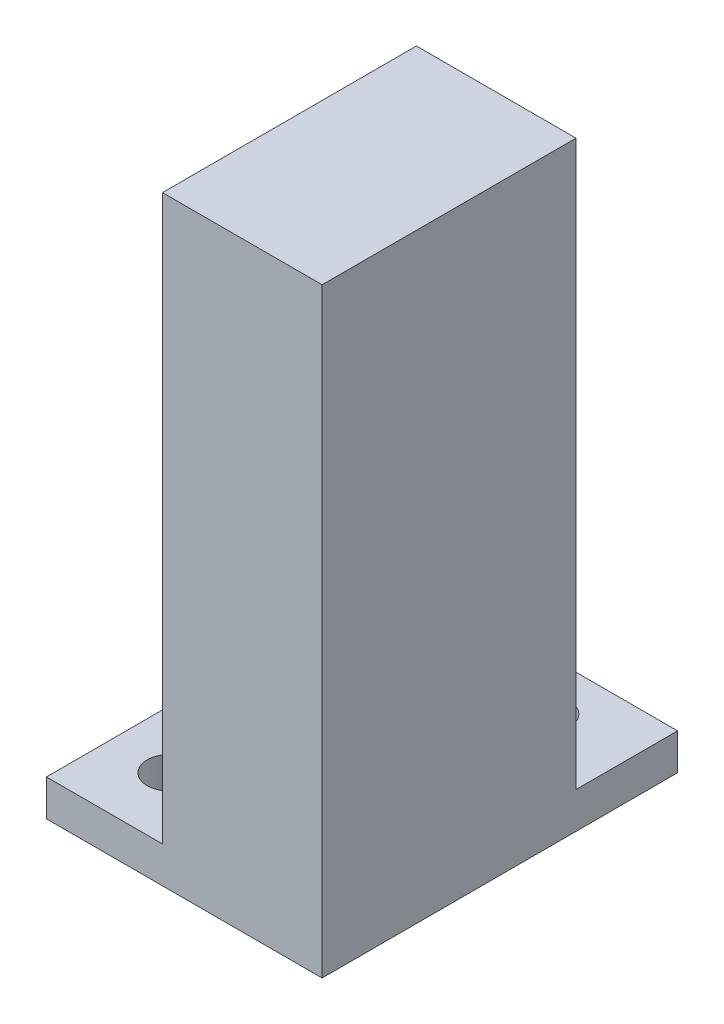
from build123d import *

# Parameters (mm, degrees)
SKETCH1_W           = 22
SKETCH1_H           = 82.75
SKETCH1_R           = 3.1
BOSS_EXTRUDE1_DEPTH = 30
SKETCH2_W           = 22
SKETCH2_H           = 82.75
BOSS_EXTRUDE2_DEPTH = 5
SKETCH3_W           = 16
SKETCH3_H           = 35
SKETCH3_R           = 3.1
SKETCH3_W_2         = 22
SKETCH3_H_2         = 14
BOSS_EXTRUDE3_DEPTH = 5
BOSS_EXTRUDE5_START = 15
SKETCH5_R           = 3.1
BOSS_EXTRUDE5_DEPTH = 15


with BuildPart() as part:
    # Sketch1 → Boss-Extrude1 (new body)
    with BuildSketch(Plane.XY):
        with Locations((0, 7.844654309)):
            Rectangle(SKETCH1_W, SKETCH1_H)
        with Locations((0, 35.719654309)):
            Circle(SKETCH1_R, mode=Mode.SUBTRACT)
        with Locations((0, 7.719654309)):
            Circle(SKETCH1_R, mode=Mode.SUBTRACT)
    extrude(amount=BOSS_EXTRUDE1_DEPTH)

    # Sketch2 → Boss-Extrude2 (add)
    with BuildSketch(Plane.XY.offset(30)):
        with Locations((0, 7.844654309)):
            Rectangle(SKETCH2_W, SKETCH2_H)
    extrude(amount=BOSS_EXTRUDE2_DEPTH)

    # Sketch3 → Boss-Extrude3 (add)
    # profile 1 of 2: a face of its own
    with BuildSketch(Plane.XZ.offset(33.530345691)):
        with Locations((-19, 17.5)):
            Rectangle(SKETCH3_W, SKETCH3_H)
        with Locations(Location((-19, 26, 0), (0, 0, 270))):
            Circle(SKETCH3_R, mode=Mode.SUBTRACT)
        with Locations(Location((-19, 9, 0), (0, 0, 270))):
            Circle(SKETCH3_R, mode=Mode.SUBTRACT)
    # profile 2 of 2: a face of its own
    with BuildSketch(Plane.XZ.offset(33.530345691)):
        with Locations((0, -7)):
            Rectangle(SKETCH3_W_2, SKETCH3_H_2)
        with Locations(Location((0, -7, 0), (0, 0, 270))):
            Circle(SKETCH3_R, mode=Mode.SUBTRACT)
    extrude(amount=-BOSS_EXTRUDE3_DEPTH)

    # Sketch5 → Boss-Extrude5 (add)
    with BuildSketch(Plane(origin=(0, 0, 30), x_dir=(-1, 0, 0), z_dir=(0, 0, -1)).offset(BOSS_EXTRUDE5_START)):
        with Locations((0, 7.719654309)):
            Circle(SKETCH5_R)
        with Locations((0, 35.719654309)):
            Circle(SKETCH5_R)
    extrude(amount=-BOSS_EXTRUDE5_DEPTH)


solid = part.part
